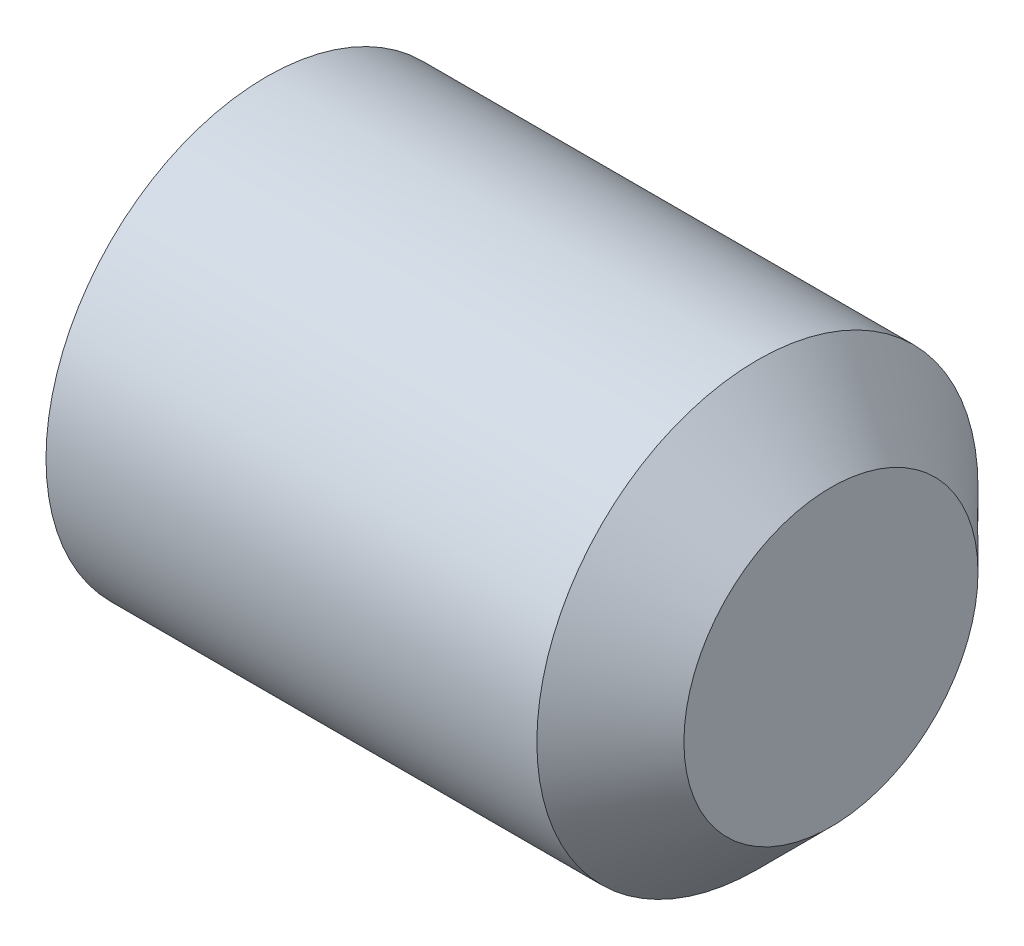
from build123d import *

# Parameters (mm, degrees)
HEX_2_DEPTH = 2.1


with BuildPart() as part:
    # BodySke → BaseBody (revolve)
    with BuildSketch(Plane.XY, mode=Mode.PRIVATE) as basebody_sk:
        Polygon((0, 0), (0, 1.2195), (0.161946751, 1.5), (3.5, 1.5), (4, 1), (4, 0), align=None)
    revolve(basebody_sk.sketch.rotate(Axis((-12.7, 0, 0), (1, 0, 0)), 90), axis=Axis((-12.7, 0, 0), (1, 0, 0)))

    # Sketch2 → Hex 2 (cut)
    with BuildSketch(Plane.ZY):
        Polygon((0.433012702, 0.75), (-0.433012702, 0.75), (-0.866025404, 0), (-0.433012702, -0.75), (0.433012702, -0.75), (0.866025404, 0), align=None)
    extrude(amount=-HEX_2_DEPTH, mode=Mode.SUBTRACT)


solid = part.part
